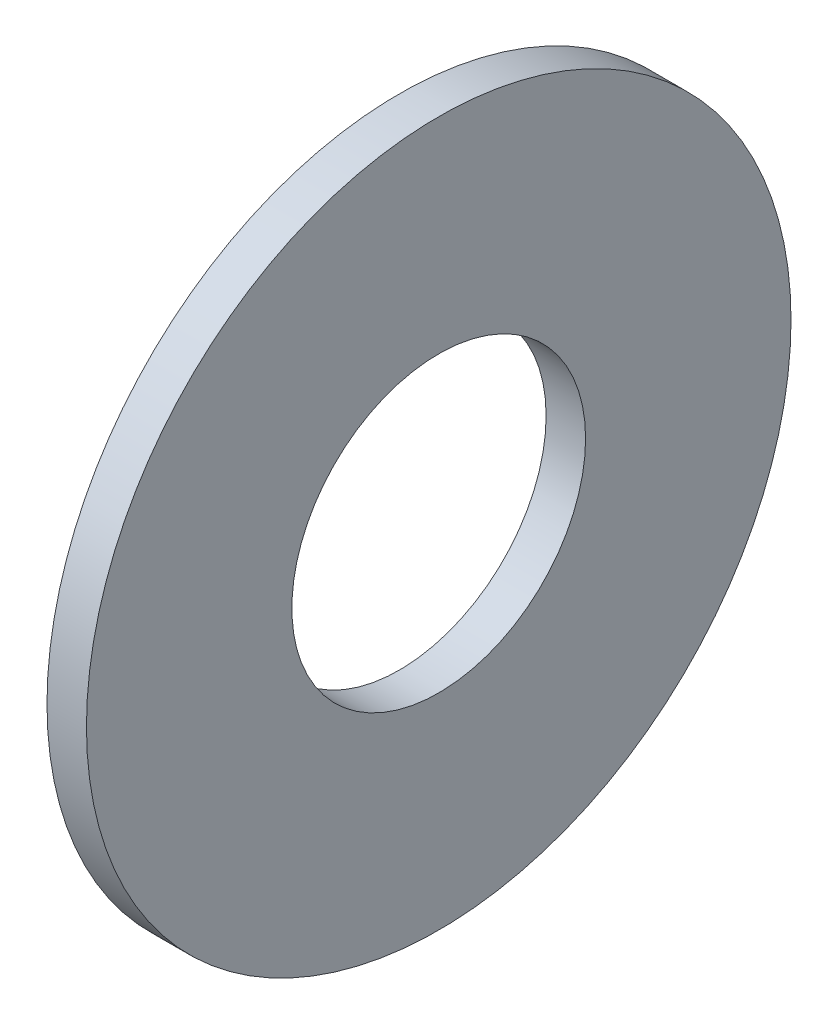
from build123d import *

# Parameters (mm, degrees)
SKETCH1_R           = 14.2875
SKETCH1_R_2         = 5.9563
BOSS_EXTRUDE1_DEPTH = 1.6002


with BuildPart() as part:
    # Sketch1 → Boss-Extrude1 (new body)
    with BuildSketch(Plane(origin=(0, 0, 0), x_dir=(0, 0, -1), z_dir=(1, 0, 0))):
        Circle(SKETCH1_R)
        Circle(SKETCH1_R_2, mode=Mode.SUBTRACT)
    extrude(amount=BOSS_EXTRUDE1_DEPTH)


solid = part.part
